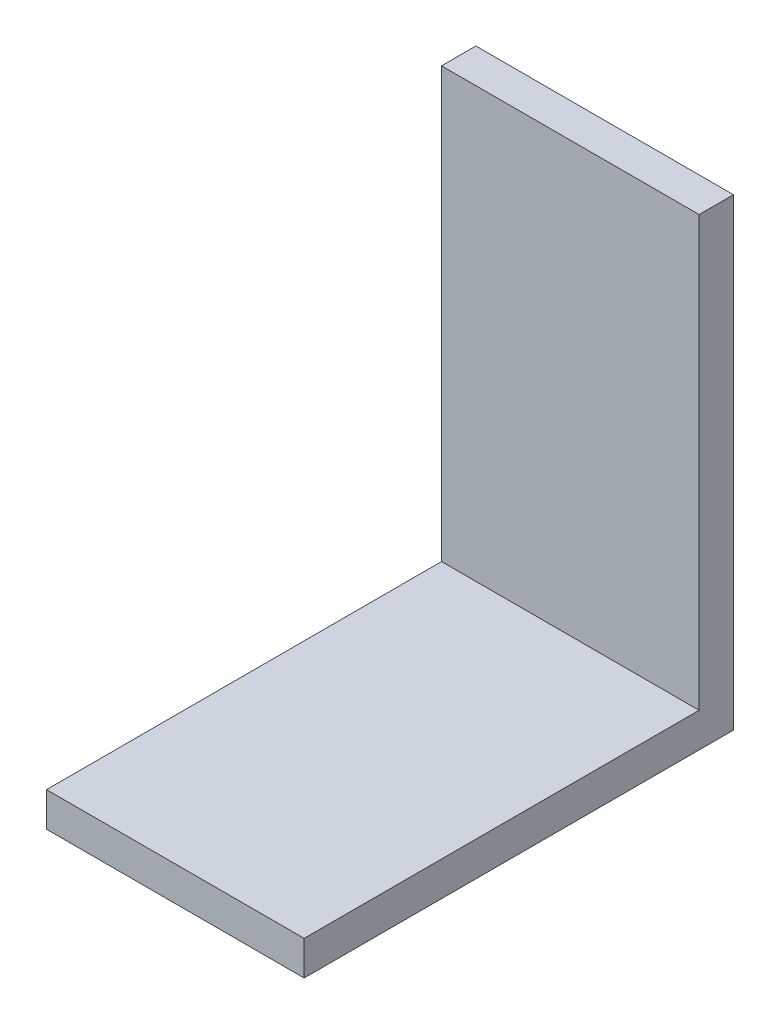
from build123d import *

# Parameters (mm, degrees)
SKETCH1_W           = 15
SKETCH1_H           = 25
BOSS_EXTRUDE1_DEPTH = 2
SKETCH2_W           = 15
SKETCH2_H           = 2
BOSS_EXTRUDE2_DEPTH = 25


with BuildPart() as part:
    # Sketch1 → Boss-Extrude1 (new body)
    with BuildSketch(Plane(origin=(0, 0, 0), x_dir=(1, 0, 0), z_dir=(0, 1, 0))):
        Rectangle(SKETCH1_W, SKETCH1_H)
    extrude(amount=BOSS_EXTRUDE1_DEPTH)

    # Sketch2 → Boss-Extrude2 (add)
    with BuildSketch(Plane(origin=(0, 2, 0), x_dir=(1, 0, 0), z_dir=(0, 1, 0))):
        with Locations((0, 11.5)):
            Rectangle(SKETCH2_W, SKETCH2_H)
    extrude(amount=BOSS_EXTRUDE2_DEPTH)


solid = part.part
